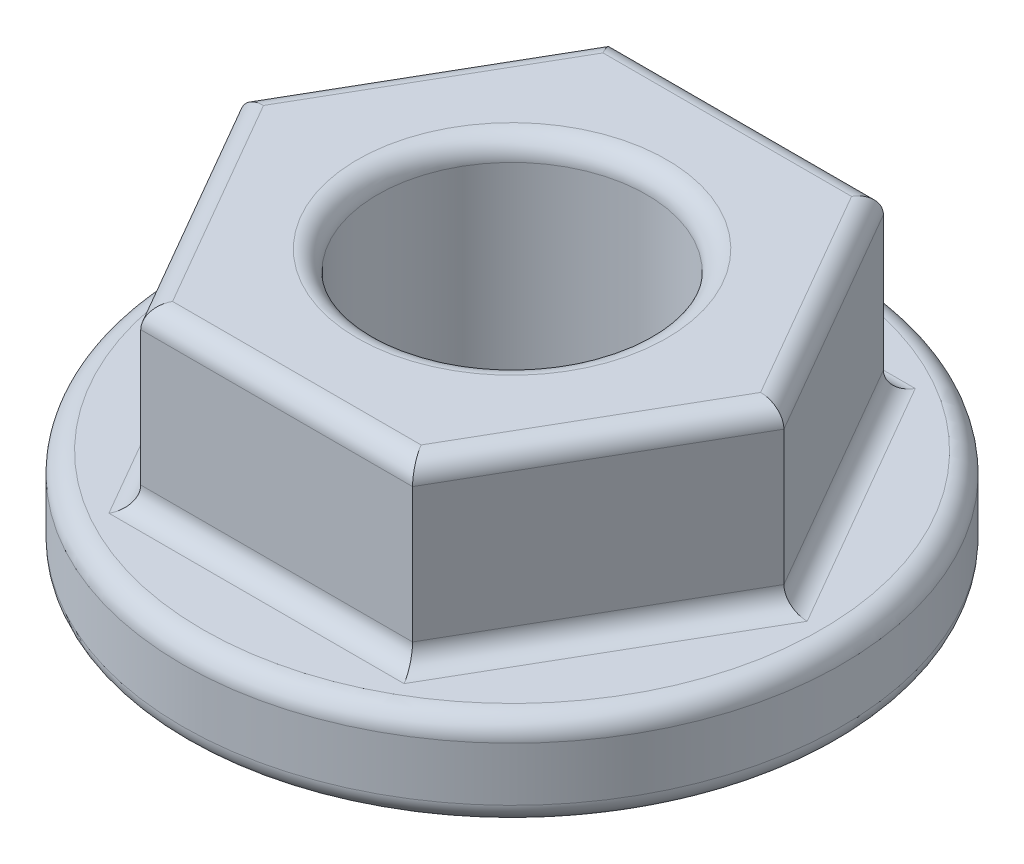
from build123d import *

# Parameters (mm, degrees)
SKETCH1_R           = 4.9
BOSS_EXTRUDE1_DEPTH = 4
SKETCH2_R           = 2
CUT_EXTRUDE1_DEPTH  = 4.8
SKETCH3_OUTSIDE_W   = 14.684
SKETCH3_OUTSIDE_H   = 14.684
CUT_EXTRUDE2_DEPTH  = 2.6
FILLET1_R           = 0.3


with BuildPart() as part:
    # Sketch1 → Boss-Extrude1 (new body)
    with BuildSketch(Plane(origin=(0, 0, 0), x_dir=(1, 0, 0), z_dir=(0, 1, 0))):
        with Locations(Location((0, 0, 0), (0, 0, 270))):
            Circle(SKETCH1_R)
    extrude(amount=BOSS_EXTRUDE1_DEPTH)

    # Sketch2 → Cut-Extrude1 (cut)
    with BuildSketch(Plane(origin=(0, 4, 0), x_dir=(1, 0, 0), z_dir=(0, 1, 0))):
        with Locations(Location((0, 0, 0), (0, 0, 270))):
            Circle(SKETCH2_R)
    extrude(amount=-CUT_EXTRUDE1_DEPTH, mode=Mode.SUBTRACT)

    # Sketch3 outside → Cut-Extrude2 (cut)
    with BuildSketch(Plane(origin=(0, 4, 0), x_dir=(1, 0, 0), z_dir=(0, 1, 0))):
        Rectangle(SKETCH3_OUTSIDE_W, SKETCH3_OUTSIDE_H)
        Polygon((4.041451884, 0), (2.020725942, 3.5), (-2.020725942, 3.5), (-4.041451884, 0), (-2.020725942, -3.5), (2.020725942, -3.5), align=None, mode=Mode.SUBTRACT)
    extrude(amount=-CUT_EXTRUDE2_DEPTH, mode=Mode.SUBTRACT)

    # Fillet1
    fillet1_edges = [part.edges().sort_by_distance(p)[0] for p in [
        (0, 1.4, 3.5),
        (3.031088913, 1.4, 1.75),
        (3.031088913, 1.4, -1.75),
        (0, 1.4, -3.5),
        (-3.031088913, 1.4, -1.75),
        (-3.031088913, 1.4, 1.75),
        (0, 1.4, -4.9),
        (0, 0, -4.9),
        (3.031088913, 4, 1.75),
        (0, 4, 3.5),
        (-3.031088913, 4, 1.75),
        (-3.031088913, 4, -1.75),
        (0, 4, -3.5),
        (3.031088913, 4, -1.75),
        (0, 0, -2),
        (0, 4, -2),
    ]]
    fillet(fillet1_edges, radius=FILLET1_R)


solid = part.part
